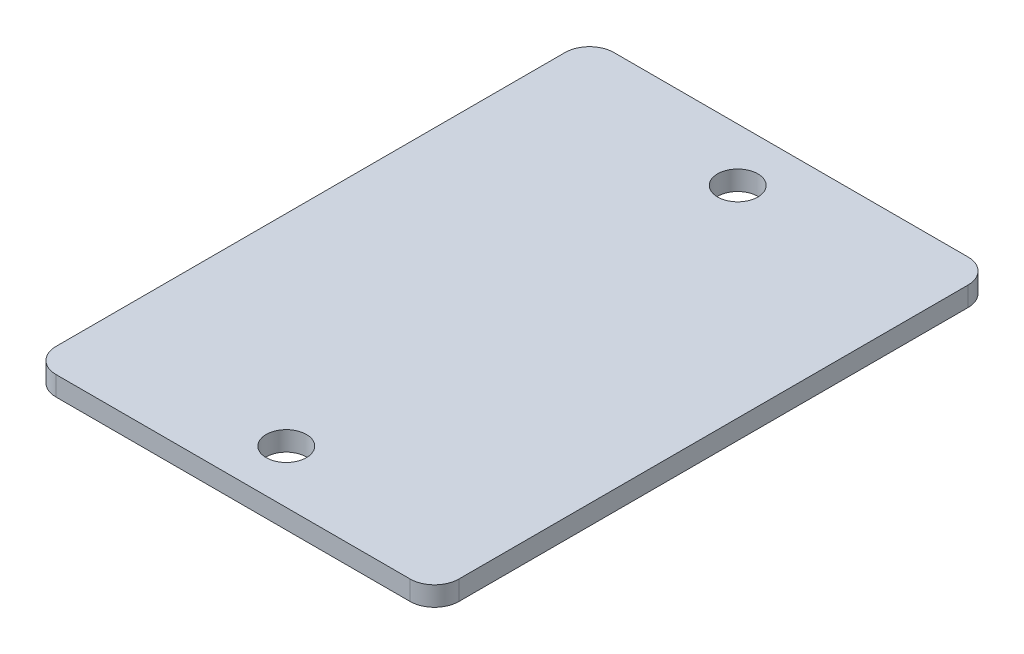
from build123d import *

# Parameters (mm, degrees)
SKETCH1_W           = 33.02
SKETCH1_H           = 45.72
SKETCH1_R           = 1.65
BOSS_EXTRUDE1_DEPTH = 1.6
FILLET1_R           = 2


with BuildPart() as part:
    # Sketch1 → Boss-Extrude1 (new body)
    with BuildSketch(Plane(origin=(0, 0, 0), x_dir=(1, 0, 0), z_dir=(0, 1, 0))):
        Rectangle(SKETCH1_W, SKETCH1_H)
        with Locations(Location((0, 18.5, 0), (0, 0, 270))):
            Circle(SKETCH1_R, mode=Mode.SUBTRACT)
        with Locations(Location((0, -18.5, 0), (0, 0, 270))):
            Circle(SKETCH1_R, mode=Mode.SUBTRACT)
    extrude(amount=BOSS_EXTRUDE1_DEPTH)

    # Fillet1
    fillet1_edges = [part.edges().sort_by_distance(p)[0] for p in [
        (16.51, 0.8, 22.86),
        (-16.51, 0.8, 22.86),
        (-16.51, 0.8, -22.86),
        (16.51, 0.8, -22.86),
    ]]
    fillet(fillet1_edges, radius=FILLET1_R)


solid = part.part
